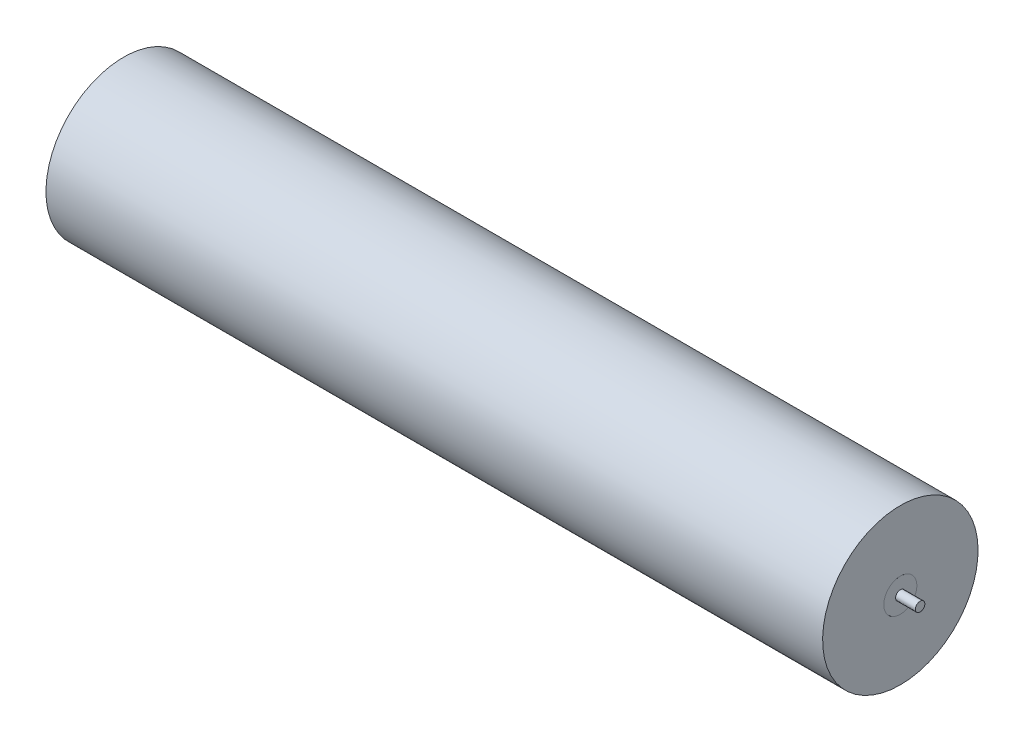
from build123d import *

# Parameters (mm, degrees)
SKETCH1_W           = 1649
SKETCH1_H           = 129.8995
SKETCH2_R           = 35.1
SKETCH2_R_2         = 10.0005
BOSS_EXTRUDE1_DEPTH = 10
SKETCH3_R           = 35.1
SKETCH3_R_2         = 10.0005
BOSS_EXTRUDE2_DEPTH = 10
SKETCH4_W           = 1733
SKETCH4_H           = 10


with BuildPart() as part:
    # Sketch1 → Revolve1 (revolve)
    with BuildSketch(Plane.XY, mode=Mode.PRIVATE) as revolve1_sk:
        with Locations((0, 100.05025)):
            Rectangle(SKETCH1_W, SKETCH1_H)
    revolve(revolve1_sk.sketch.rotate(Axis((-824.5, 0, 0), (1, 0, 0)), 180), axis=Axis((-824.5, 0, 0), (1, 0, 0)))


with BuildPart() as body_2:
    # Sketch2 → Boss-Extrude1 (new body)
    with BuildSketch(Plane.ZY.offset(824.5)):
        with Locations(Location((0, 0, 0), (0, 0, 270))):
            Circle(SKETCH2_R)
        with Locations(Location((0, 0, 0), (0, 0, 270))):
            Circle(SKETCH2_R_2, mode=Mode.SUBTRACT)
    extrude(amount=-BOSS_EXTRUDE1_DEPTH)


with BuildPart() as body_3:
    # Sketch3 → Boss-Extrude2 (new body)
    with BuildSketch(Plane(origin=(824.5, 0, 0), x_dir=(0, 0, -1), z_dir=(1, 0, 0))):
        with Locations(Location((0, 0, 0), (0, 0, 90))):
            Circle(SKETCH3_R)
        with Locations(Location((0, 0, 0), (0, 0, 90))):
            Circle(SKETCH3_R_2, mode=Mode.SUBTRACT)
    extrude(amount=-BOSS_EXTRUDE2_DEPTH)


with BuildPart() as body_4:
    # Sketch4 → Revolve3 (revolve)
    with BuildSketch(Plane.XY, mode=Mode.PRIVATE) as revolve3_sk:
        with Locations((0, 5)):
            Rectangle(SKETCH4_W, SKETCH4_H)
    revolve(revolve3_sk.sketch.rotate(Axis((-866.5, 0, 0), (1, 0, 0)), 180), axis=Axis((-866.5, 0, 0), (1, 0, 0)))


solid = Compound([part.part, body_2.part, body_3.part, body_4.part])
